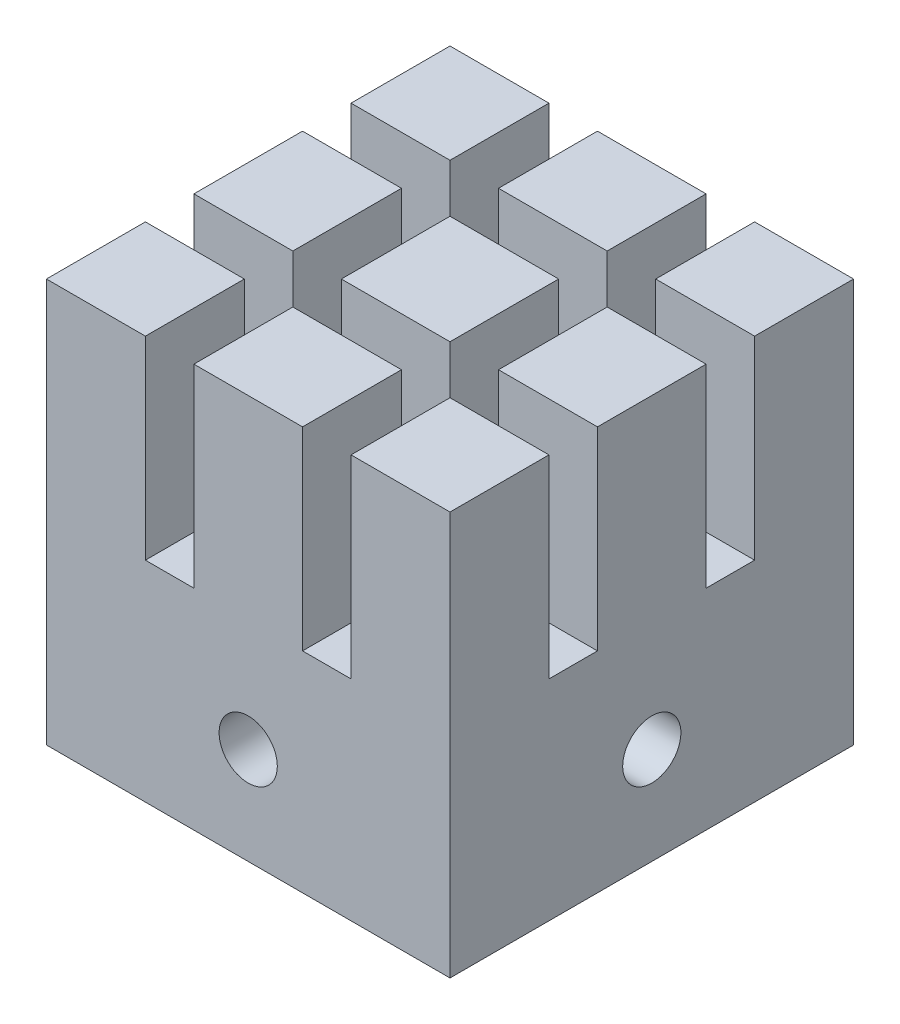
from build123d import *

# Parameters (mm, degrees)
SKETCH2_W           = 26.416
SKETCH2_H           = 26.416
BOSS_EXTRUDE1_DEPTH = 26.416
SKETCH4_W           = 3.175
SKETCH4_H           = 26.416
SKETCH4_W_2         = 26.416
SKETCH4_H_2         = 3.175
CUT_EXTRUDE3_DEPTH  = 12.7
SKETCH7_R           = 1.905
CUT_EXTRUDE5_DEPTH  = 35.934004294
SKETCH8_R           = 1.905
CUT_EXTRUDE6_DEPTH  = 40.796215498


with BuildPart() as part:
    # Sketch2 → Boss-Extrude1 (new body)
    with BuildSketch(Plane.XY):
        with Locations((5.08, -0.508)):
            Rectangle(SKETCH2_W, SKETCH2_H)
    extrude(amount=-BOSS_EXTRUDE1_DEPTH)

    # Sketch4 → Cut-Extrude3 (cut)
    with BuildSketch(Plane(origin=(0, 12.7, 0), x_dir=(1, 0, 0), z_dir=(0, 1, 0))):
        with Locations((-0.0635, 13.208)):
            Rectangle(SKETCH4_W, SKETCH4_H)
        with Locations((10.2235, 13.208)):
            Rectangle(SKETCH4_W, SKETCH4_H)
        with Locations((5.08, 18.3515)):
            Rectangle(SKETCH4_W_2, SKETCH4_H_2)
        with Locations((5.08, 8.0645)):
            Rectangle(SKETCH4_W_2, SKETCH4_H_2)
    extrude(amount=-CUT_EXTRUDE3_DEPTH, mode=Mode.SUBTRACT)

    # Sketch7 → Cut-Extrude5 (cut, through all)
    with BuildSketch(Plane.XY):
        with Locations((5.08, -7.366)):
            Circle(SKETCH7_R)
    extrude(amount=-CUT_EXTRUDE5_DEPTH, mode=Mode.SUBTRACT)

    # Sketch8 → Cut-Extrude6 (cut, through all)
    with BuildSketch(Plane(origin=(18.288, 0, 0), x_dir=(0, 0, -1), z_dir=(1, 0, 0))):
        with Locations(Location((13.208, -7.366, 0), (0, 0, 90))):
            Circle(SKETCH8_R)
    extrude(amount=-CUT_EXTRUDE6_DEPTH, mode=Mode.SUBTRACT)


solid = part.part
